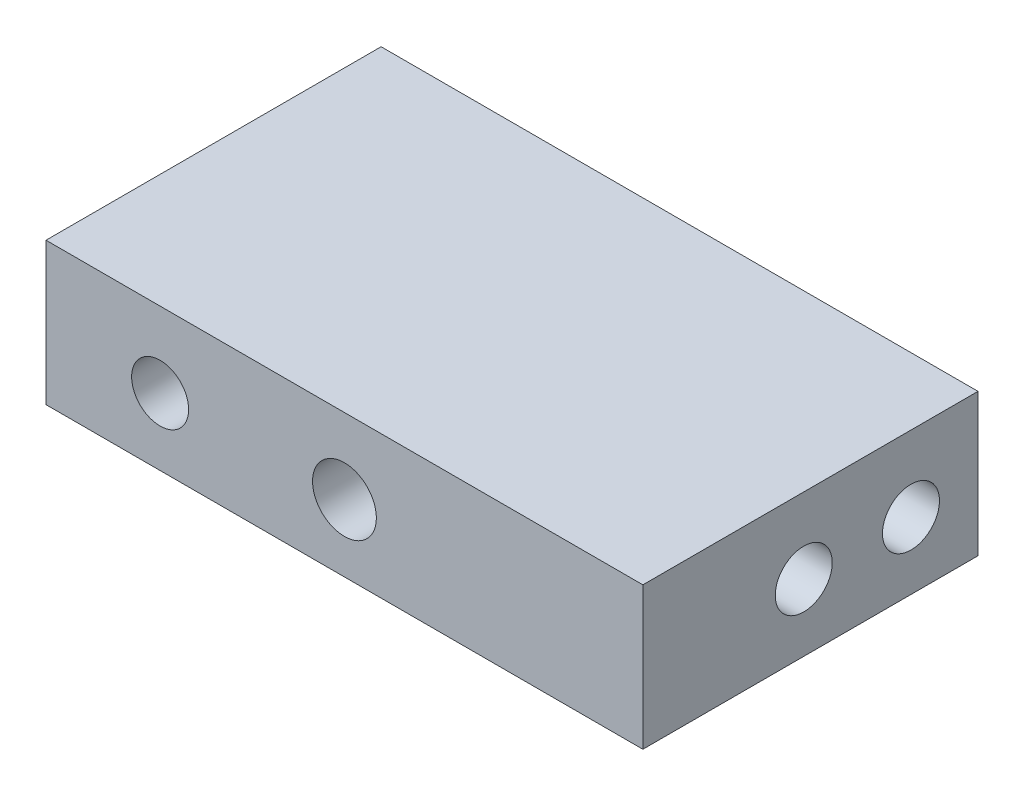
from build123d import *

# Parameters (mm, degrees)
SKETCH1_W           = 56.55
SKETCH1_H           = 12.7
BOSS_EXTRUDE1_DEPTH = 31.75
SKETCH2_R           = 2.7
SKETCH2_R_2         = 3.025
CUT_EXTRUDE1_DEPTH  = 10
CUT_EXTRUDE2_DEPTH  = 8
SKETCH4_W           = 56.55
SKETCH4_H           = 31.75
BOSS_EXTRUDE2_DEPTH = 0.79375


with BuildPart() as part:
    # Sketch1 → Boss-Extrude1 (new body)
    with BuildSketch(Plane.XY):
        Rectangle(SKETCH1_W, SKETCH1_H)
    extrude(amount=BOSS_EXTRUDE1_DEPTH)

    # Sketch2 → Cut-Extrude1 (cut)
    with BuildSketch(Plane.XY.offset(31.75)):
        with Locations((-17.4625, 0)):
            Circle(SKETCH2_R)
        Circle(SKETCH2_R_2)
    extrude(amount=-CUT_EXTRUDE1_DEPTH, mode=Mode.SUBTRACT)

    # Sketch3 → Cut-Extrude2 (cut)
    with BuildSketch(Plane.ZY.offset(28.275)):
        with BuildLine():
            ThreePointArc((3.65, 0), (6.35, -2.7), (9.05, 0))
            Line((9.05, 0), (3.65, 0))
        make_face()
        with BuildLine():
            Line((3.65, 0), (9.05, 0))
            ThreePointArc((9.05, 0), (6.35, 2.7), (3.65, 0))
        make_face()
        with BuildLine():
            ThreePointArc((13.81, 0), (16.51, -2.7), (19.21, 0))
            Line((19.21, 0), (13.81, 0))
        make_face()
        with BuildLine():
            Line((13.81, 0), (19.21, 0))
            ThreePointArc((19.21, 0), (16.51, 2.7), (13.81, 0))
        make_face()
    cut_extrude2 = extrude(amount=-CUT_EXTRUDE2_DEPTH, mode=Mode.SUBTRACT)

    # Sketch4 → Boss-Extrude2 (add)
    with BuildSketch(Plane(origin=(0, 6.35, 0), x_dir=(1, 0, 0), z_dir=(0, 1, 0))):
        with Locations((0, -15.875)):
            Rectangle(SKETCH4_W, SKETCH4_H)
    extrude(amount=BOSS_EXTRUDE2_DEPTH)

    # Mirror1: Cut-Extrude2 across plane
    add(cut_extrude2.mirror(Plane(origin=(0, 0, 0), x_dir=(0, 0, 1), z_dir=(1, 0, 0))), mode=Mode.SUBTRACT)


solid = part.part
